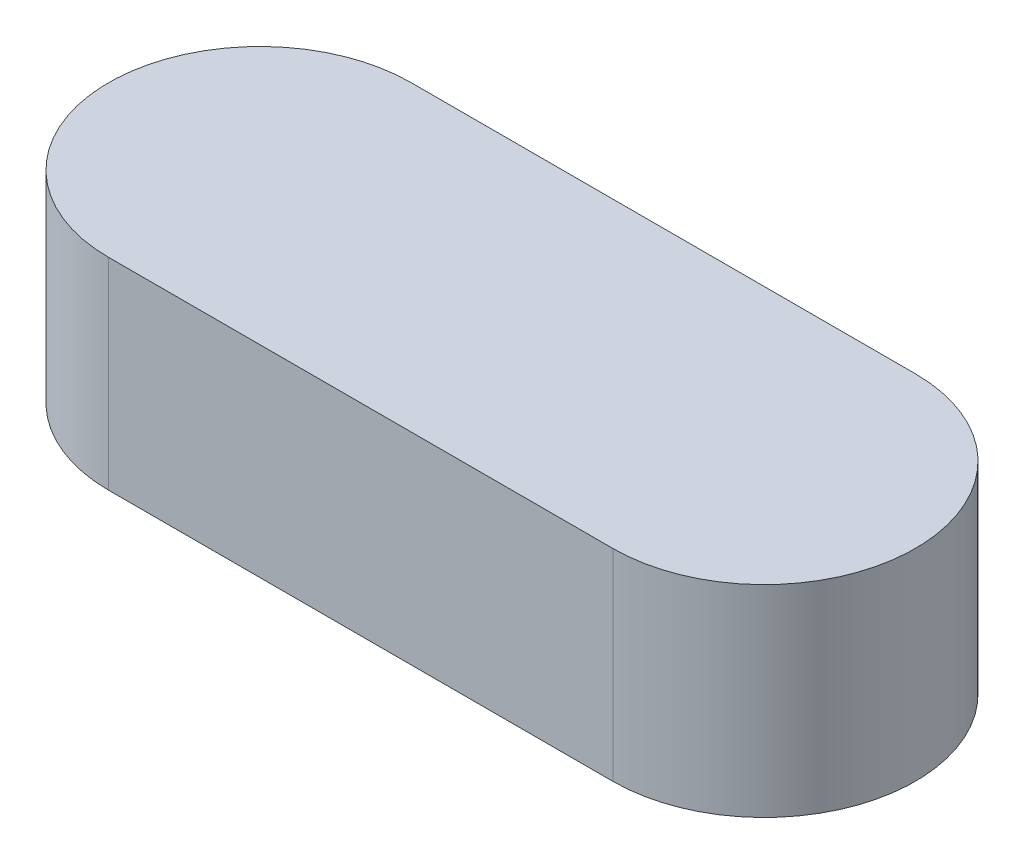
from build123d import *

# Parameters (mm, degrees)
BOSS_EXTRUDE1_DEPTH = 8


with BuildPart() as part:
    # Sketch2 → Boss-Extrude1 (new body)
    with BuildSketch(Plane(origin=(0, 0, 0), x_dir=(1, 0, 0), z_dir=(0, 1, 0))):
        with BuildLine():
            Line((-4, 7.828571429), (16, 7.828571429))
            ThreePointArc((16, 7.828571429), (22, 1.828571429), (16, -4.171428571))
            Line((16, -4.171428571), (-4, -4.171428571))
            ThreePointArc((-4, -4.171428571), (-10, 1.828571429), (-4, 7.828571429))
        make_face()
    extrude(amount=BOSS_EXTRUDE1_DEPTH)


solid = part.part
